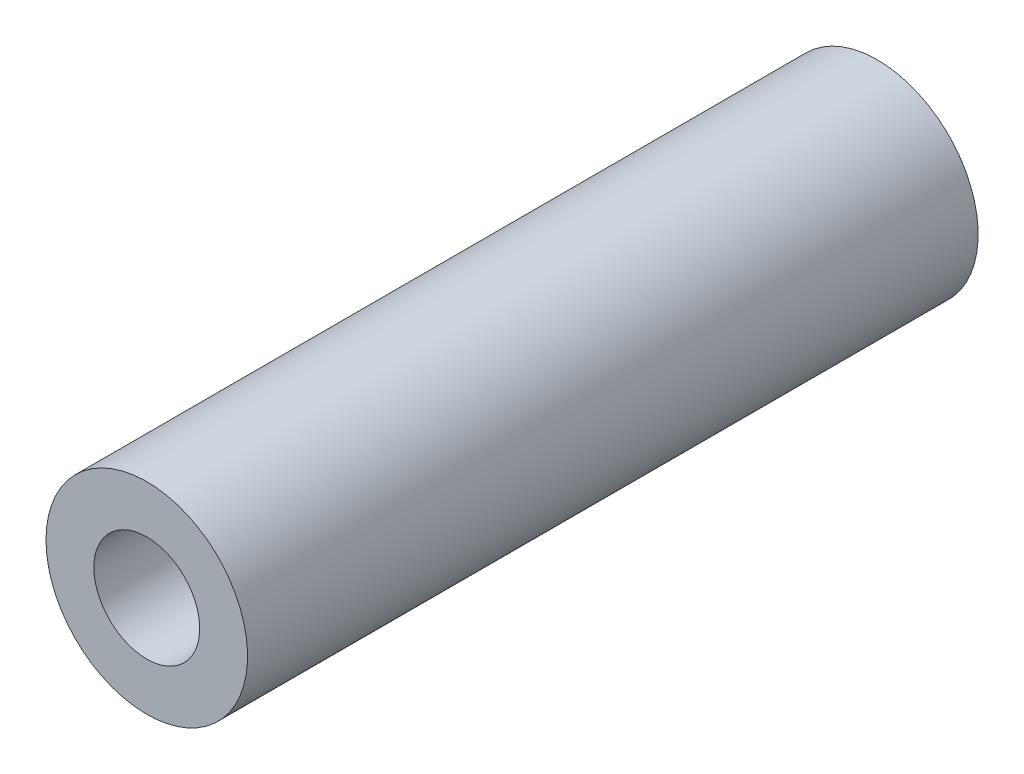
from build123d import *

# Parameters (mm, degrees)
SKETCH_1_R      = 4
SKETCH_1_R_2    = 2.1
EXTRUDE_1_DEPTH = 29


with BuildPart() as part:
    # ｽｹｯﾁ1 → ﾎﾞｽ - 押し出し1 (new body)
    with BuildSketch(Plane.XY):
        with Locations(Location((0, 0, 0), (0, 0, 180))):
            Circle(SKETCH_1_R)
        with Locations(Location((0, 0, 0), (0, 0, 180))):
            Circle(SKETCH_1_R_2, mode=Mode.SUBTRACT)
    extrude(amount=EXTRUDE_1_DEPTH)


solid = part.part
